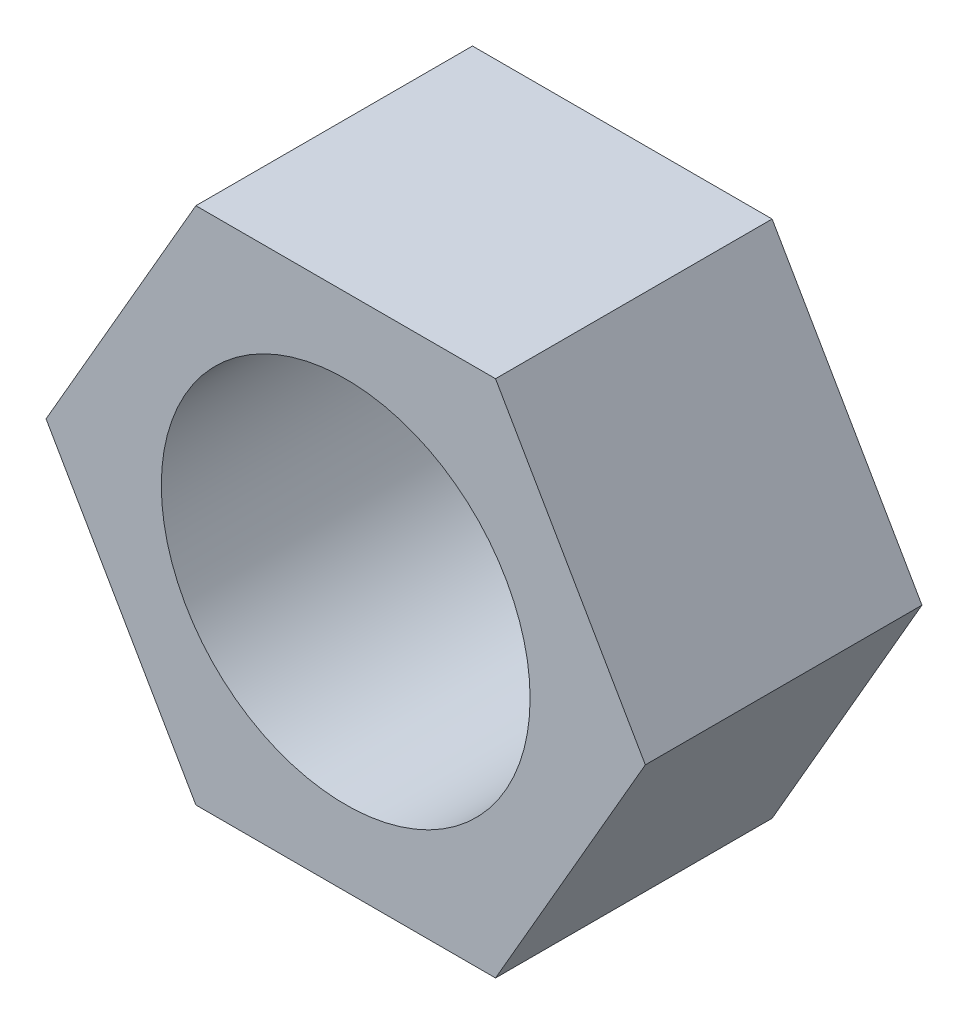
from build123d import *

# Parameters (mm, degrees)
BOSS_EXTRUDE1_DEPTH = 6
SKETCH2_R           = 4
CUT_EXTRUDE1_DEPTH  = 6


with BuildPart() as part:
    # Sketch1 → Boss-Extrude1 (new body)
    with BuildSketch(Plane.XY):
        Polygon((6.5, 0), (3.25, 5.629165125), (-3.25, 5.629165125), (-6.5, 0), (-3.25, -5.629165125), (3.25, -5.629165125), align=None)
    extrude(amount=BOSS_EXTRUDE1_DEPTH)

    # Sketch2 → Cut-Extrude1 (cut)
    with BuildSketch(Plane.XY):
        Circle(SKETCH2_R)
    extrude(amount=CUT_EXTRUDE1_DEPTH, mode=Mode.SUBTRACT)


solid = part.part
